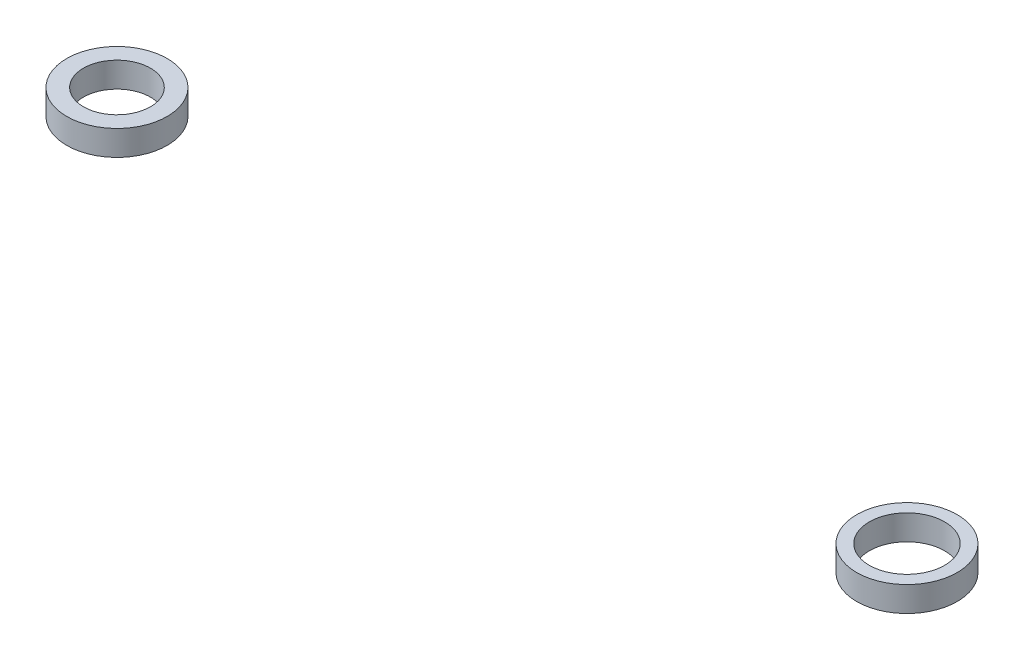
from build123d import *

# Parameters (mm, degrees)
SKETCH1_R             = 6
SKETCH1_R_2           = 4
BOSS_EXTRUDE1_DEPTH   = 3
SKETCH1_R_3           = 4.5
BOSS_EXTRUDE1_2_DEPTH = 3


with BuildPart() as part:
    # Sketch1 → Boss-Extrude1 (new body)
    with BuildSketch(Plane(origin=(0, 0, 0), x_dir=(1, 0, 0), z_dir=(0, 1, 0))):
        with Locations(Location((0, 0, 0), (0, 0, 270))):
            Circle(SKETCH1_R)
        with Locations(Location((0, 0, 0), (0, 0, 270))):
            Circle(SKETCH1_R_2, mode=Mode.SUBTRACT)
    extrude(amount=BOSS_EXTRUDE1_DEPTH)


with BuildPart() as body_2:
    # Sketch1 → Boss-Extrude1 2 (new body)
    with BuildSketch(Plane(origin=(0, 0, 0), x_dir=(1, 0, 0), z_dir=(0, 1, 0))):
        with Locations(Location((94.369960569, 0, 0), (0, 0, 270))):
            Circle(SKETCH1_R)
        with Locations(Location((94.369960569, 0, 0), (0, 0, 270))):
            Circle(SKETCH1_R_3, mode=Mode.SUBTRACT)
    extrude(amount=BOSS_EXTRUDE1_2_DEPTH)


solid = Compound([part.part, body_2.part])
